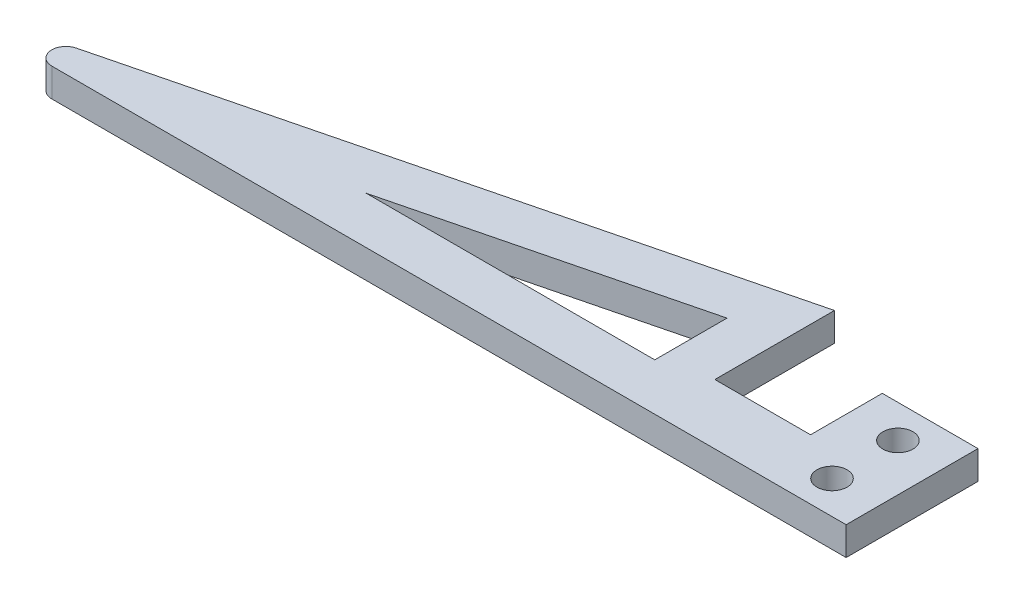
from build123d import *

# Parameters (mm, degrees)
SKETCH2_R           = 1.6
BOSS_EXTRUDE1_DEPTH = 3.0226
FILLET1_R           = 1.5


with BuildPart() as part:
    # Sketch2 → Boss-Extrude1 (new body)
    with BuildSketch(Plane(origin=(0, 0, 0), x_dir=(1, 0, 0), z_dir=(0, 1, 0))):
        Polygon((0, -6.35), (-96.5, -6.35), (-20.32, 12.73), (-20.32, 0.03), (-10.16, 0.03), (-10.16, 7.65), (0, 7.65), align=None)
        with Locations(Location((-5, -2.85, 0), (0, 0, 270))):
            Circle(SKETCH2_R, mode=Mode.SUBTRACT)
        with Locations(Location((-5, 4.15, 0), (0, 0, 270))):
            Circle(SKETCH2_R, mode=Mode.SUBTRACT)
        Polygon((-25.32, -1.35), (-25.32, 6.323263145), (-55.956749809, -1.35), align=None, mode=Mode.SUBTRACT)
    extrude(amount=BOSS_EXTRUDE1_DEPTH)

    # Fillet1
    fillet1_edges = [part.edges().sort_by_distance(p)[0] for p in [
        (-96.5, 1.5113, 6.35),
    ]]
    fillet(fillet1_edges, radius=FILLET1_R)


solid = part.part
